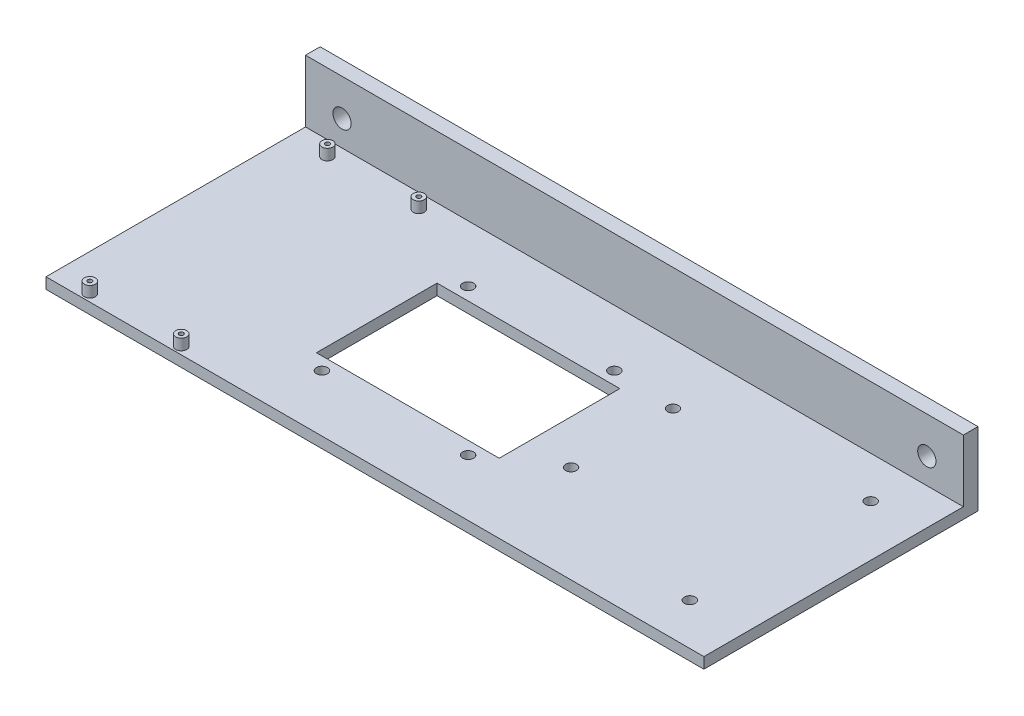
from build123d import *

# Parameters (mm, degrees)
SKETCH1_W             = 180
SKETCH1_H             = 75
BOSS_EXTRUDE1_DEPTH   = 3
SKETCH2_W             = 180
SKETCH2_H             = 4
BOSS_EXTRUDE2_DEPTH   = 17
SKETCH3_R             = 1.5
BOSS_EXTRUDE3_DEPTH   = 3
SKETCH4_R             = 0.6
CUT_EXTRUDE1_DEPTH    = 5
SKETCH5_W             = 50
SKETCH5_H             = 33
CUT_EXTRUDE2_DEPTH    = 5
F_3_0MM_DOWEL_HOLE1_D = 3
CUT_EXTRUDE3_REACH    = 100.971
SKETCH8_R             = 1.5
CUT_EXTRUDE4_REACH    = 118.366
SKETCH9_R             = 2.5


with BuildPart() as part:
    # Sketch1 → Boss-Extrude1 (new body)
    with BuildSketch(Plane(origin=(0, 0, 0), x_dir=(1, 0, 0), z_dir=(0, 1, 0))):
        Rectangle(SKETCH1_W, SKETCH1_H)
    extrude(amount=BOSS_EXTRUDE1_DEPTH)

    # Sketch2 → Boss-Extrude2 (add)
    with BuildSketch(Plane(origin=(0, 3, 0), x_dir=(1, 0, 0), z_dir=(0, 1, 0))):
        with Locations((0, 35.5)):
            Rectangle(SKETCH2_W, SKETCH2_H)
    extrude(amount=BOSS_EXTRUDE2_DEPTH)

    # Sketch3 → Boss-Extrude3 (add)
    with BuildSketch(Plane(origin=(0, 3, 0), x_dir=(1, 0, 0), z_dir=(0, 1, 0))):
        with Locations(Location((-80, 29.5, 0), (0, 0, 270))):
            Circle(SKETCH3_R)
        with Locations(Location((-55, 29.5, 0), (0, 0, 270))):
            Circle(SKETCH3_R)
        with Locations(Location((-55, -35.5, 0), (0, 0, 270))):
            Circle(SKETCH3_R)
        with Locations(Location((-80, -35.5, 0), (0, 0, 270))):
            Circle(SKETCH3_R)
    extrude(amount=BOSS_EXTRUDE3_DEPTH)

    # Sketch4 → Cut-Extrude1 (cut)
    with BuildSketch(Plane(origin=(0, 6, 0), x_dir=(1, 0, 0), z_dir=(0, 1, 0))):
        with Locations(Location((-80, 29.5, 0), (0, 0, 270))):
            Circle(SKETCH4_R)
        with Locations(Location((-55, 29.5, 0), (0, 0, 270))):
            Circle(SKETCH4_R)
        with Locations(Location((-55, -35.5, 0), (0, 0, 270))):
            Circle(SKETCH4_R)
        with Locations(Location((-80, -35.5, 0), (0, 0, 270))):
            Circle(SKETCH4_R)
    extrude(amount=-CUT_EXTRUDE1_DEPTH, mode=Mode.SUBTRACT)

    # Sketch5 → Cut-Extrude2 (cut)
    with BuildSketch(Plane(origin=(0, 3, 0), x_dir=(1, 0, 0), z_dir=(0, 1, 0))):
        with Locations((-10, -2)):
            Rectangle(SKETCH5_W, SKETCH5_H)
    extrude(amount=-CUT_EXTRUDE2_DEPTH, mode=Mode.SUBTRACT)

    # Ø3.0mm Dowel Hole1 (through all)
    with Locations(Plane(origin=(-30, 3, -18), x_dir=(0, 0, 1), z_dir=(0, 1, 0))):
        with Locations((0, 0), (0, 40), (40, 40), (40, 0)):
            Hole(F_3_0MM_DOWEL_HOLE1_D / 2)

    # Sketch8 → Cut-Extrude3 (cut, up to next)
    with BuildSketch(Plane(origin=(0, 3, 0), x_dir=(1, 0, 0), z_dir=(0, 1, 0)), mode=Mode.PRIVATE) as cut_extrude3_sk1:
        with Locations(Location((76, 22.15, 0), (0, 0, 270))):
            Circle(SKETCH8_R)
    cut_extrude3_tool1 = extrude(cut_extrude3_sk1.sketch, amount=-CUT_EXTRUDE3_REACH, mode=Mode.PRIVATE) & part.part
    # Sketch8 → Cut-Extrude3 (cut, up to next)
    with BuildSketch(Plane(origin=(0, 3, 0), x_dir=(1, 0, 0), z_dir=(0, 1, 0)), mode=Mode.PRIVATE) as cut_extrude3_sk2:
        with Locations(Location((74.7, -26.05, 0), (0, 0, 270))):
            Circle(SKETCH8_R)
    cut_extrude3_tool2 = extrude(cut_extrude3_sk2.sketch, amount=-CUT_EXTRUDE3_REACH, mode=Mode.PRIVATE) & part.part
    # Sketch8 → Cut-Extrude3 (cut, up to next)
    with BuildSketch(Plane(origin=(0, 3, 0), x_dir=(1, 0, 0), z_dir=(0, 1, 0)), mode=Mode.PRIVATE) as cut_extrude3_sk3:
        with Locations(Location((27.000808713, -10.85, 0), (0, 0, 270))):
            Circle(SKETCH8_R)
    cut_extrude3_tool3 = extrude(cut_extrude3_sk3.sketch, amount=-CUT_EXTRUDE3_REACH, mode=Mode.PRIVATE) & part.part
    # Sketch8 → Cut-Extrude3 (cut, up to next)
    with BuildSketch(Plane(origin=(0, 3, 0), x_dir=(1, 0, 0), z_dir=(0, 1, 0)), mode=Mode.PRIVATE) as cut_extrude3_sk4:
        with Locations(Location((27.000808713, 17.05, 0), (0, 0, 270))):
            Circle(SKETCH8_R)
    cut_extrude3_tool4 = extrude(cut_extrude3_sk4.sketch, amount=-CUT_EXTRUDE3_REACH, mode=Mode.PRIVATE) & part.part
    add(cut_extrude3_tool1.solids().sort_by_distance((76, 3, -22.15))[0], mode=Mode.SUBTRACT)
    add(cut_extrude3_tool2.solids().sort_by_distance((74.7, 3, 26.05))[0], mode=Mode.SUBTRACT)
    add(cut_extrude3_tool3.solids().sort_by_distance((27.000809, 3, 10.85))[0], mode=Mode.SUBTRACT)
    add(cut_extrude3_tool4.solids().sort_by_distance((27.000809, 3, -17.05))[0], mode=Mode.SUBTRACT)

    # Sketch9 → Cut-Extrude4 (cut, up to next)
    with BuildSketch(Plane.XY.offset(-33.5), mode=Mode.PRIVATE) as cut_extrude4_sk1:
        with Locations((-80, 10)):
            Circle(SKETCH9_R)
    cut_extrude4_tool1 = extrude(cut_extrude4_sk1.sketch, amount=-CUT_EXTRUDE4_REACH, mode=Mode.PRIVATE) & part.part
    # Sketch9 → Cut-Extrude4 (cut, up to next)
    with BuildSketch(Plane.XY.offset(-33.5), mode=Mode.PRIVATE) as cut_extrude4_sk2:
        with Locations((80, 10)):
            Circle(SKETCH9_R)
    cut_extrude4_tool2 = extrude(cut_extrude4_sk2.sketch, amount=-CUT_EXTRUDE4_REACH, mode=Mode.PRIVATE) & part.part
    add(cut_extrude4_tool1.solids().sort_by_distance((-80, 10, -33.5))[0], mode=Mode.SUBTRACT)
    add(cut_extrude4_tool2.solids().sort_by_distance((80, 10, -33.5))[0], mode=Mode.SUBTRACT)


solid = part.part
